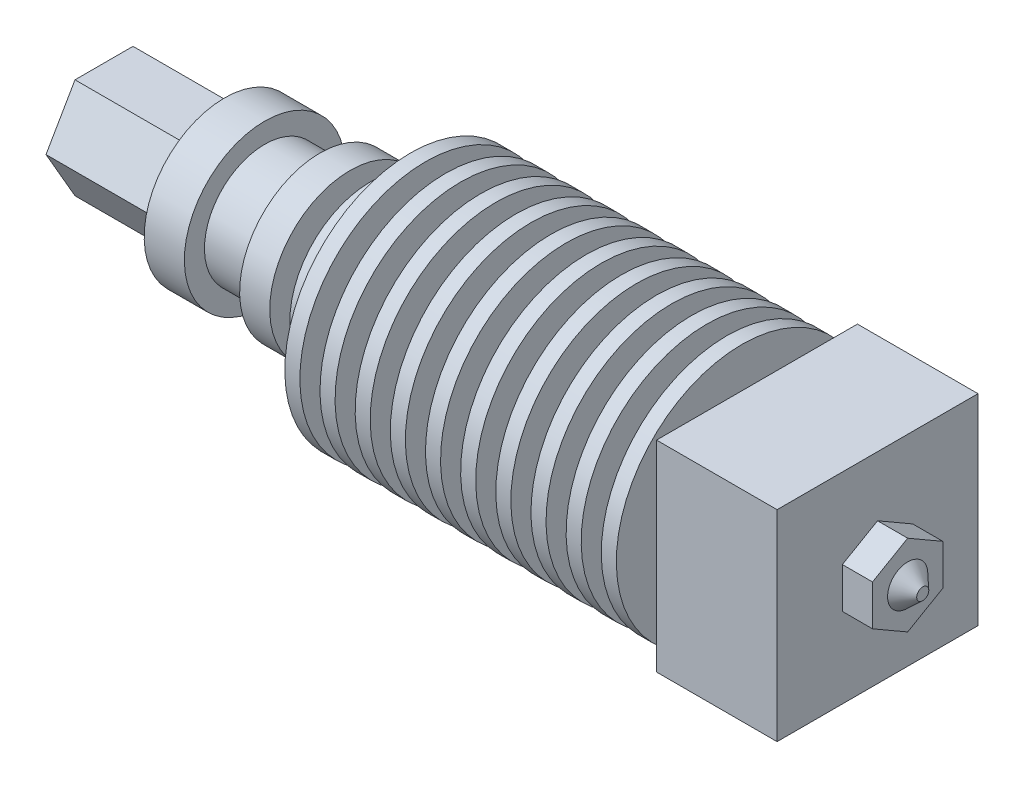
from build123d import *

# Parameters (mm, degrees)
SKETCH_2_R      = 3
EXTRUDE_1_DEPTH = 1.5
SKETCH_3_W      = 20
SKETCH_3_H      = 20
EXTRUDE_2_DEPTH = 12
EXTRUDE_3_DEPTH = 3
EXTRUDE_4_DEPTH = 12


with BuildPart() as part:
    # 草圖1 → 旋轉1 (revolve)
    with BuildSketch(Plane.XY):
        Polygon((0, 0), (-51.5, 0), (-51.5, 8), (-47.5, 8), (-47.5, 6), (-42, 6), (-42, 8), (-39, 8), (-39, 4.5), (-37, 4.5), (-37, 8), (-35.5, 8), (-35.5, 7.5), (-33, 7.5), (-33, 12.5), (-31.5, 12.5), (-31.5, 7.5), (-29.5, 7.5), (-29.5, 12.5), (-28, 12.5), (-28, 7.5), (-26, 7.5), (-26, 12.5), (-24.5, 12.5), (-24.5, 7.5), (-22.5, 7.5), (-22.5, 12.5), (-21, 12.5), (-21, 7.5), (-19, 7.5), (-19, 12.5), (-17.5, 12.5), (-17.5, 7.5), (-15.5, 7.5), (-15.5, 12.5), (-14, 12.5), (-14, 7.5), (-12, 7.5), (-12, 12.5), (-10.5, 12.5), (-10.5, 7.5), (-8.5, 7.5), (-8.5, 12.5), (-7, 12.5), (-7, 7.5), (-5, 7.5), (-5, 12.5), (-3.5, 12.5), (-3.5, 7.5), (-1.5, 7.5), (-1.5, 12.5), (0, 12.5), align=None)
    revolve(axis=Axis((0, 0, 0), (-1, 0, 0)))

    # 草圖2 → 填料-伸長1 (add)
    with BuildSketch(Plane(origin=(0, 0, 0), x_dir=(0, 0, -1), z_dir=(1, 0, 0))):
        with Locations(Location((0, 0, 0), (0, 0, 90))):
            Circle(SKETCH_2_R)
    extrude(amount=EXTRUDE_1_DEPTH)

    # 草圖3 → 填料-伸長2 (add)
    with BuildSketch(Plane(origin=(1.5, 0, 0), x_dir=(0, 0, -1), z_dir=(1, 0, 0))):
        Rectangle(SKETCH_3_W, SKETCH_3_H)
    extrude(amount=EXTRUDE_2_DEPTH)

    # 草圖4 → 填料-伸長3 (add)
    with BuildSketch(Plane(origin=(13.5, 0, 0), x_dir=(0, 0, -1), z_dir=(1, 0, 0))):
        Polygon((0, 4.041451884), (-3.5, 2.020725942), (-3.5, -2.020725942), (0, -4.041451884), (3.5, -2.020725942), (3.5, 2.020725942), align=None)
    extrude(amount=EXTRUDE_3_DEPTH)

    # 草圖6 → 旋轉2 (revolve)
    with BuildSketch(Plane.XY, mode=Mode.PRIVATE) as revolve_2_sk:
        Polygon((16.5, 0), (18, 0), (18, 0.6), (16.5, 2), align=None)
    revolve(revolve_2_sk.sketch.rotate(Axis((16.5, 0, 0), (1, 0, 0)), 180), axis=Axis((16.5, 0, 0), (1, 0, 0)))

    # 草圖7 → 填料-伸長4 (add)
    with BuildSketch(Plane.ZY.offset(51.5)):
        Polygon((-5.773502692, 0), (-2.886751346, -5), (2.886751346, -5), (5.773502692, 0), (2.886751346, 5), (-2.886751346, 5), align=None)
    extrude(amount=EXTRUDE_4_DEPTH)


solid = part.part
